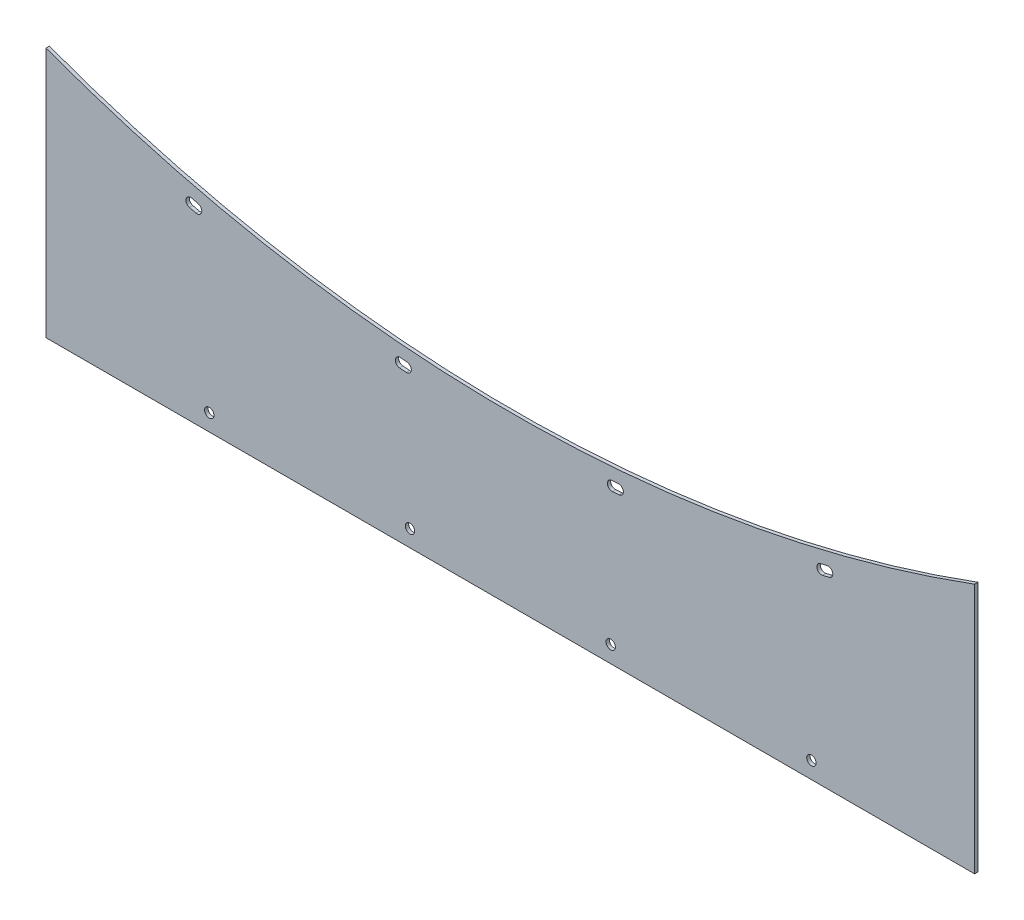
from build123d import *

# Parameters (mm, degrees)
SKETCH1_R           = 7
BOSS_EXTRUDE1_DEPTH = 5


with BuildPart() as part:
    # Sketch1 → Boss-Extrude1 (new body)
    with BuildSketch(Plane.XY):
        with BuildLine():
            Line((1651.475381164, 459.392203427), (263.475381164, 459.392203427))
            Line((263.475381164, 459.392203427), (263.475381164, 834.392203427))
            ThreePointArc((263.475381164, 834.392203427), (957.475381164, 709.790289397), (1651.475381164, 834.392203427))
            Line((1651.475381164, 834.392203427), (1651.475381164, 459.392203427))
        make_face()
        with Locations((507.475381164, 484.392203427)):
            Circle(SKETCH1_R, mode=Mode.SUBTRACT)
        with Locations((807.475381164, 484.392203427)):
            Circle(SKETCH1_R, mode=Mode.SUBTRACT)
        with Locations((1107.475381164, 484.392203427)):
            Circle(SKETCH1_R, mode=Mode.SUBTRACT)
        with Locations((1407.475381164, 484.392203427)):
            Circle(SKETCH1_R, mode=Mode.SUBTRACT)
        with BuildLine():
            Line((1434.054921304, 734.606048794), (1424.329475699, 732.278881466))
            ThreePointArc((1424.329475699, 732.278881466), (1415.892646645, 737.457676261), (1421.07144144, 745.894505314))
            Line((1421.07144144, 745.894505314), (1430.796887045, 748.221672642))
            ThreePointArc((1430.796887045, 748.221672642), (1439.233716099, 743.042877847), (1434.054921304, 734.606048794))
        make_face(mode=Mode.SUBTRACT)
        with BuildLine():
            Line((1119.982718617, 684.308820718), (1110.01296021, 683.531699563))
            ThreePointArc((1110.01296021, 683.531699563), (1102.490144515, 689.966545639), (1108.924990592, 697.489361333))
            Line((1108.924990592, 697.489361333), (1118.894748999, 698.266482489))
            ThreePointArc((1118.894748999, 698.266482489), (1126.417564694, 691.831636413), (1119.982718617, 684.308820718))
        make_face(mode=Mode.SUBTRACT)
        with BuildLine():
            Line((801.909045951, 683.762551995), (791.940463281, 684.554612313))
            ThreePointArc((791.940463281, 684.554612313), (785.516897635, 692.087062405), (793.049347727, 698.510628051))
            Line((793.049347727, 698.510628051), (803.017930397, 697.718567733))
            ThreePointArc((803.017930397, 697.718567733), (809.441496043, 690.186117641), (801.909045951, 683.762551995))
        make_face(mode=Mode.SUBTRACT)
        with BuildLine():
            Line((487.665932753, 732.980693573), (477.94398541, 735.322432212))
            ThreePointArc((477.94398541, 735.322432212), (472.777839317, 743.767012399), (481.222419504, 748.933158492))
            Line((481.222419504, 748.933158492), (490.944366848, 746.591419854))
            ThreePointArc((490.944366848, 746.591419854), (496.110512941, 738.146839666), (487.665932753, 732.980693573))
        make_face(mode=Mode.SUBTRACT)
    extrude(amount=BOSS_EXTRUDE1_DEPTH)


solid = part.part
